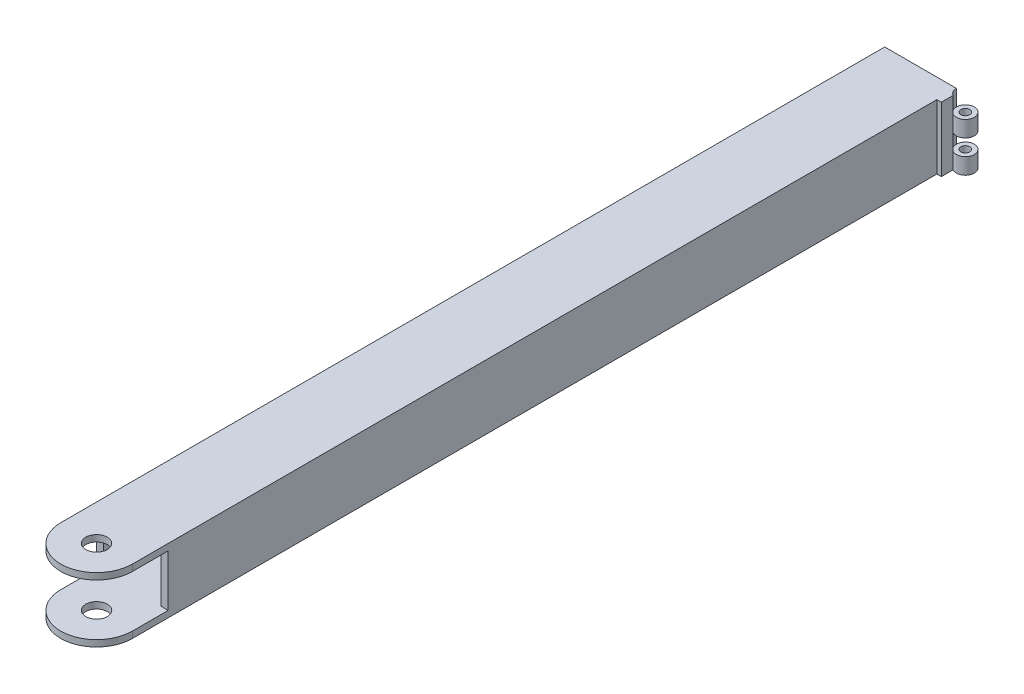
from build123d import *

# Parameters (mm, degrees)
SKETCH1_W               = 40
SKETCH1_H               = 36
SKETCH1_W_2             = 32
SKETCH1_H_2             = 28.8
BOSS_EXTRUDE1_DEPTH     = 480
SKETCH2_W               = 50
SKETCH2_H               = 28.8
CUT_EXTRUDE1_DEPTH      = 40
FILLET2_RADIUS          = 20
FILLET2_LENGTH          = 3.6
FILLET3_RADIUS          = 20
FILLET3_LENGTH          = 3.6
CUT_EXTRUDE2_DEPTH      = 482.763427421
CUT_EXTRUDE2_DEPTH_BACK = 482.763427421
SKETCH3_R               = 6
SKETCH4_R               = 2.5
BOSS_EXTRUDE2_DEPTH     = 36
SKETCH5_R               = 5
CUT_EXTRUDE3_DEPTH      = 9
CUT_EXTRUDE4_START      = -9
SKETCH6_R               = 5
CUT_EXTRUDE4_DEPTH      = 9


with BuildPart() as part:
    # Sketch1 → Boss-Extrude1 (new body)
    with BuildSketch(Plane.XY):
        Rectangle(SKETCH1_W, SKETCH1_H)
        Rectangle(SKETCH1_W_2, SKETCH1_H_2, mode=Mode.SUBTRACT)
    extrude(amount=BOSS_EXTRUDE1_DEPTH)

    # Sketch2 → Cut-Extrude1 (cut)
    with BuildSketch(Plane.XY.offset(480)):
        Rectangle(SKETCH2_W, SKETCH2_H)
    extrude(amount=-CUT_EXTRUDE1_DEPTH, mode=Mode.SUBTRACT)

    # Fillet2: full round fillet: the end face becomes a half cylinder, R = half its width
    fillet2_face = Plane((0, -16.2, 480), x_dir=(0, -1, 0), z_dir=(0, 0, 1))  # on the end face: x along it, z out of the body
    fillet2_slab = fillet2_face.offset(-FILLET2_RADIUS / 2) * Box(FILLET2_LENGTH, 2 * FILLET2_RADIUS, FILLET2_RADIUS, mode=Mode.PRIVATE)  # the body's end, R deep
    fillet2_round = Plane((0, -16.2, 460), x_dir=(0, 0, 1), z_dir=(0, -1, 0)) * Cylinder(FILLET2_RADIUS, FILLET2_LENGTH, mode=Mode.PRIVATE)  # its axis R under the face
    add(fillet2_slab - fillet2_round, mode=Mode.SUBTRACT)

    # Fillet3: full round fillet: the end face becomes a half cylinder, R = half its width
    fillet3_face = Plane((0, 16.2, 480), x_dir=(0, -1, 0), z_dir=(0, 0, 1))  # on the end face: x along it, z out of the body
    fillet3_slab = fillet3_face.offset(-FILLET3_RADIUS / 2) * Box(FILLET3_LENGTH, 2 * FILLET3_RADIUS, FILLET3_RADIUS, mode=Mode.PRIVATE)  # the body's end, R deep
    fillet3_round = Plane((0, 16.2, 460), x_dir=(0, 0, 1), z_dir=(0, -1, 0)) * Cylinder(FILLET3_RADIUS, FILLET3_LENGTH, mode=Mode.PRIVATE)  # its axis R under the face
    add(fillet3_slab - fillet3_round, mode=Mode.SUBTRACT)

    # Sketch3 → Cut-Extrude2 (cut, two sides: drawn at the far end of the back side and taken through both)
    with BuildSketch(Plane(origin=(0, 18, 0), x_dir=(1, 0, 0), z_dir=(0, 1, 0)).offset(-CUT_EXTRUDE2_DEPTH_BACK)):
        with Locations(Location((0, -460, 0), (0, 0, 270))):
            Circle(SKETCH3_R)
    extrude(amount=CUT_EXTRUDE2_DEPTH + CUT_EXTRUDE2_DEPTH_BACK, mode=Mode.SUBTRACT)

    # Sketch4 → Boss-Extrude2 (add)
    with BuildSketch(Plane.XZ.offset(18)):
        with BuildLine():
            Line((20, 0), (20, 10.898129461))
            Line((20, 10.898129461), (22.5, 10.898129461))
            Line((22.5, 10.898129461), (22.5, 4.330127019))
            ThreePointArc((22.5, 4.330127019), (29.330127019, -2.5), (20, 0))
        make_face()
        with Locations(Location((25, 0, 0), (0, 0, 270))):
            Circle(SKETCH4_R, mode=Mode.SUBTRACT)
    extrude(amount=-BOSS_EXTRUDE2_DEPTH)

    # Sketch5 → Cut-Extrude3 (cut)
    with BuildSketch(Plane(origin=(0, -9, 0), x_dir=(-1, 0, 0), z_dir=(0, -1, 0))):
        with Locations((-25, 0)):
            Circle(SKETCH5_R)
    extrude(amount=-CUT_EXTRUDE3_DEPTH, mode=Mode.SUBTRACT)

    # Sketch6 → Cut-Extrude4 (cut)
    with BuildSketch(Plane(origin=(0, 18, 0), x_dir=(1, 0, 0), z_dir=(0, 1, 0)).offset(CUT_EXTRUDE4_START)):
        with Locations((25, 0)):
            Circle(SKETCH6_R)
    extrude(amount=CUT_EXTRUDE4_DEPTH, mode=Mode.SUBTRACT)


solid = part.part
